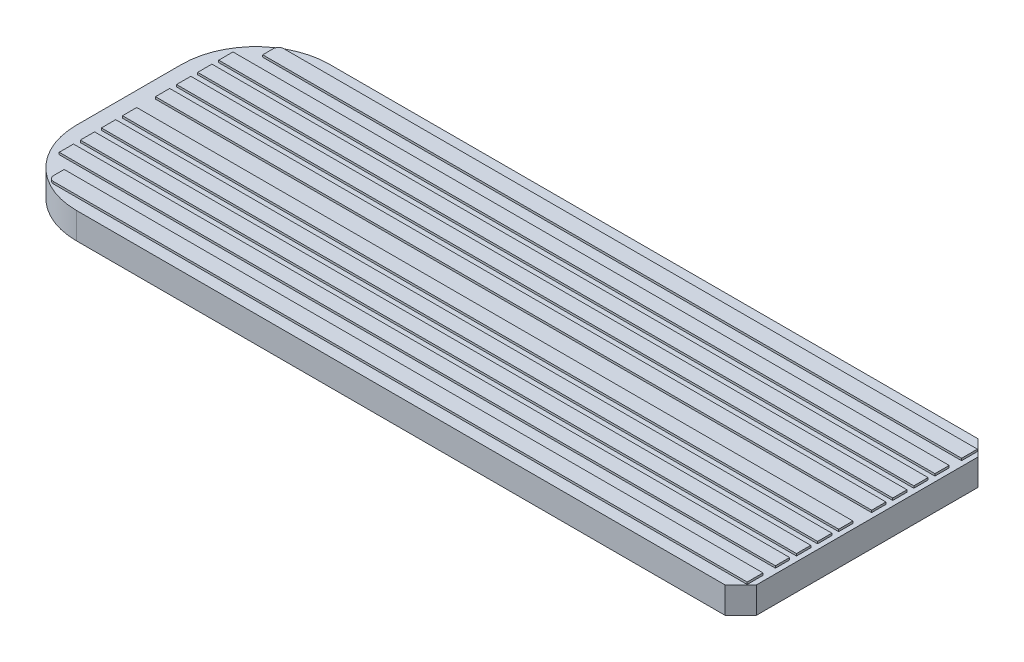
from build123d import *

# Parameters (mm, degrees)
BOSS_EXTRUDE1_DEPTH = 62.5
SHELL1_T            = -10
SKETCH2_W           = 3395.798784502
SKETCH2_H           = 67.61947807
BOSS_EXTRUDE2_DEPTH = 10


with BuildPart() as part:
    # Sketch1 → Boss-Extrude1 (new, symmetric)
    with BuildSketch(Plane(origin=(0, 0, 0), x_dir=(1, 0, 0), z_dir=(0, 1, 0))):
        with BuildLine():
            Line((-1400, 600), (1675, 600))
            Line((1675, 600), (1750, 525))
            Line((1750, 525), (1750, -525))
            Line((1750, -525), (1675, -600))
            Line((1675, -600), (-1400, -600))
            ThreePointArc((-1400, -600), (-1647.487373415, -497.487373415), (-1750, -250))
            Line((-1750, -250), (-1750, 250))
            ThreePointArc((-1750, 250), (-1647.487373415, 497.487373415), (-1400, 600))
        make_face()
    extrude(amount=BOSS_EXTRUDE1_DEPTH, both=True)

    # Shell1
    shell1_openings = [part.faces().sort_by_distance(p)[0] for p in [
        (18.879959891, -62.5, 0),
    ]]
    offset(amount=SHELL1_T, openings=shell1_openings, kind=Kind.INTERSECTION)

    # Sketch2 → Boss-Extrude2 (add)
    with BuildSketch(Plane(origin=(0, 62.5, 0), x_dir=(1, 0, 0), z_dir=(0, 1, 0))):
        with Locations((28.460206267, -278.179088726)):
            Rectangle(SKETCH2_W, SKETCH2_H)
        with BuildLine():
            Line((-1562.167945827, -545.750164928), (1726.359598518, -545.750164928))
            Line((1726.359598518, -545.750164928), (1726.359598518, -470.762339089))
            Line((1726.359598518, -470.762339089), (-1587.167945827, -470.762339089))
            Line((-1587.167945827, -470.762339089), (-1587.167945827, -520.750164928))
            ThreePointArc((-1587.167945827, -520.750164928), (-1579.845615357, -538.427834457), (-1562.167945827, -545.750164928))
        make_face()
        with Locations((28.460206267, -378.179088726)):
            Rectangle(SKETCH2_W, SKETCH2_H)
        with Locations((28.460206267, -178.179088726)):
            Rectangle(SKETCH2_W, SKETCH2_H)
        with Locations((28.460206267, -78.179088726)):
            Rectangle(SKETCH2_W, SKETCH2_H)
    boss_extrude2 = extrude(amount=BOSS_EXTRUDE2_DEPTH)

    # Mirror1: Boss-Extrude2 across plane
    add(boss_extrude2.mirror(Plane.XY))


solid = part.part
